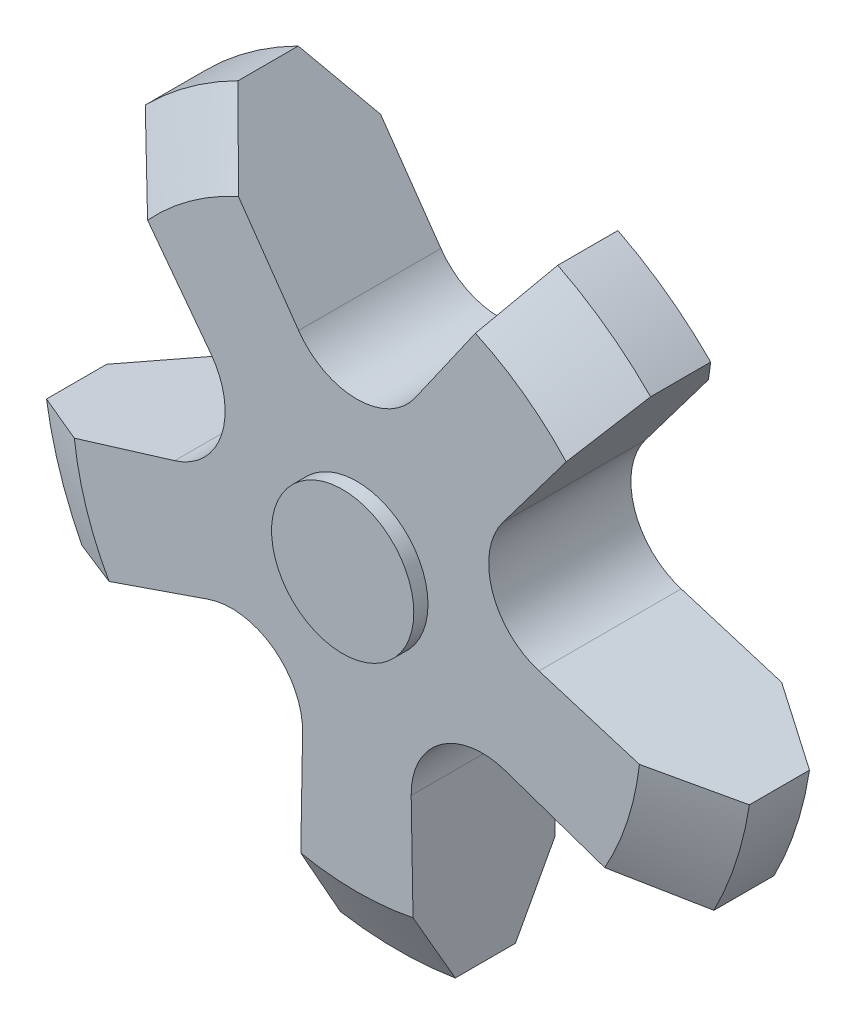
from build123d import *

# Parameters (mm, degrees)
SKETCH1_R                = 25
BOSS_EXTRUDE1_DEPTH      = 10
CHAMFER1_SIZE            = 5
CHAMFER1_SIZE2           = 2.886751346
CHAMFER2_SIZE            = 5
CHAMFER2_SIZE2           = 2.886751346
CUT_EXTRUDE1_DEPTH       = 37.742346142
CIRPATTERN1_COUNT        = 5
BOSS_EXTRUDE2_DEPTH      = 1
BOSS_EXTRUDE2_DEPTH_BACK = 12
SKETCH3_R                = 5


with BuildPart() as part:
    # Sketch1 → Boss-Extrude1 (new body)
    with BuildSketch(Plane.XY):
        Circle(SKETCH1_R)
    extrude(amount=BOSS_EXTRUDE1_DEPTH)

    # Chamfer1
    chamfer1_edges = [part.edges().sort_by_distance(p)[0] for p in [
        (-25, 0, 10),
    ]]
    chamfer1_side = [part.faces().sort_by_distance(p)[0] for p in [
        (0, 0, 10),
    ]]
    chamfer(chamfer1_edges, length=CHAMFER1_SIZE, length2=CHAMFER1_SIZE2, reference=chamfer1_side[0])

    # Chamfer2
    chamfer2_edges = [part.edges().sort_by_distance(p)[0] for p in [
        (-25, 0, 0),
    ]]
    chamfer2_side = [part.faces().sort_by_distance(p)[0] for p in [
        (0, 0, 0),
    ]]
    chamfer(chamfer2_edges, length=CHAMFER2_SIZE, length2=CHAMFER2_SIZE2, reference=chamfer2_side[0])

    # Sketch2 → Cut-Extrude1 (cut, through all)
    with BuildSketch(Plane.XY.offset(10)):
        with BuildLine():
            Line((11.23772214, 22.331896496), (4.095760221, 12.132117818))
            ThreePointArc((4.095760221, 12.132117818), (0, 10), (-4.095760221, 12.132117818))
            Line((-4.095760221, 12.132117818), (-11.23772214, 22.331896496))
            ThreePointArc((-11.23772214, 22.331896496), (0, 25), (11.23772214, 22.331896496))
        make_face()
    cut_extrude1 = extrude(amount=-CUT_EXTRUDE1_DEPTH, mode=Mode.SUBTRACT)

    # CirPattern1: Cut-Extrude1 ×5 about axis
    cirpattern1_axis = Axis((0, 0, 0), (0, 0, 1))
    for i in range(1, CIRPATTERN1_COUNT):
        add(cut_extrude1.rotate(cirpattern1_axis, i * 360 / CIRPATTERN1_COUNT), mode=Mode.SUBTRACT)

    # Sketch3 → Boss-Extrude2 (add, two sides: drawn at the far end of the back side and taken through both)
    with BuildSketch(Plane.XY.offset(10).offset(-BOSS_EXTRUDE2_DEPTH_BACK)):
        Circle(SKETCH3_R)
    extrude(amount=BOSS_EXTRUDE2_DEPTH + BOSS_EXTRUDE2_DEPTH_BACK)


solid = part.part
